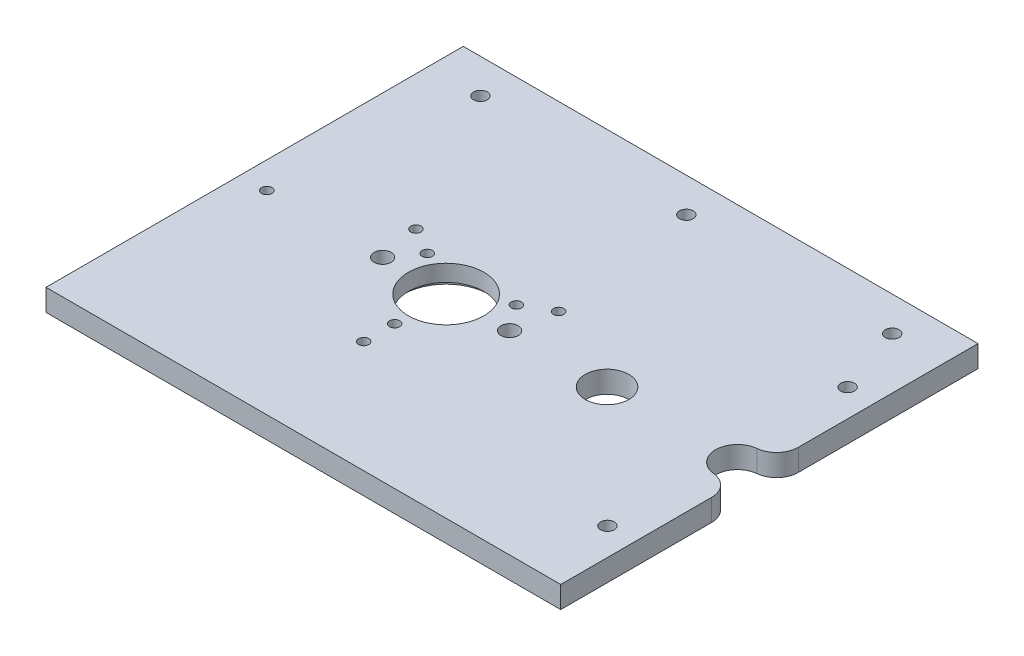
from build123d import *

# Parameters (mm, degrees)
CROQUIS1_W              = 150
CROQUIS1_H              = 101.6
SALIENTE_EXTRUIR1_DEPTH = 3.175
CROQUIS2_R              = 2
CROQUIS2_R_2            = 11
CROQUIS2_R_3            = 1.5
CROQUIS2_R_4            = 6.35
CORTAR_EXTRUIR1_DEPTH   = 91.807282197
REDONDEO1_R             = 6.35
CROQUIS3_R              = 1.5
CORTAR_EXTRUIR2_DEPTH   = 91.807282197
CORTAR_EXTRUIR3_START   = -3.175
CROQUIS4_R              = 12.5
CORTAR_EXTRUIR3_DEPTH   = 1.5
CROQUIS8_R              = 2.5
CORTAR_EXTRUIR5_DEPTH   = 91.807282197
CHAFL_N2_SIZE           = 2.5
CROQUIS9_R              = 2
SALIENTE_EXTRUIR2_DEPTH = 6.35


with BuildPart() as part:
    # Croquis1 → Saliente-Extruir1 (new, symmetric)
    with BuildSketch(Plane(origin=(0, 0, 0), x_dir=(1, 0, 0), z_dir=(0, 1, 0))):
        Rectangle(CROQUIS1_W, CROQUIS1_H)
    extrude(amount=SALIENTE_EXTRUIR1_DEPTH, both=True)

    # Croquis2 → Cortar-Extruir1 (cut, through all)
    with BuildSketch(Plane(origin=(0, 3.175, 0), x_dir=(1, 0, 0), z_dir=(0, 1, 0))):
        with Locations(Location((67, 40.8, 0), (0, 0, 270))):
            Circle(CROQUIS2_R)
        with Locations(Location((67, -29.2, 0), (0, 0, 90))):
            Circle(CROQUIS2_R)
        with Locations(Location((-15, 5.8, 0), (0, 0, 270))):
            Circle(CROQUIS2_R_2)
        with Locations(Location((-67.25, 5.8, 0), (0, 0, 270))):
            Circle(CROQUIS2_R_3)
        with Locations(Location((31.9, 5.8, 0), (0, 0, 270))):
            Circle(CROQUIS2_R_4)
        with Locations((69.9, 5.8)):
            Circle(CROQUIS2_R_4)
    extrude(amount=-CORTAR_EXTRUIR1_DEPTH, mode=Mode.SUBTRACT)

    # Redondeo1
    redondeo1_edges = [part.edges().sort_by_distance(p)[0] for p in [
        (75, 0, -2.016813512),
        (75, 0, -9.583186488),
    ]]
    fillet(redondeo1_edges, radius=REDONDEO1_R)

    # Croquis3 → Cortar-Extruir2 (cut, through all)
    with BuildSketch(Plane(origin=(0, 3.175, 0), x_dir=(1, 0, 0), z_dir=(0, 1, 0))):
        with Locations(Location((-15, -9.2, 0), (0, 0, 270))):
            Circle(CROQUIS3_R)
        with Locations(Location((-15, -18.2, 0), (0, 0, 270))):
            Circle(CROQUIS3_R)
        with Locations(Location((-27.990381057, 13.3, 0), (0, 0, 270))):
            Circle(CROQUIS3_R)
        with Locations(Location((-35.784609691, 17.8, 0), (0, 0, 270))):
            Circle(CROQUIS3_R)
        with Locations(Location((-2.009618943, 13.3, 0), (0, 0, 270))):
            Circle(CROQUIS3_R)
        with Locations(Location((5.784609691, 17.8, 0), (0, 0, 270))):
            Circle(CROQUIS3_R)
    extrude(amount=-CORTAR_EXTRUIR2_DEPTH, mode=Mode.SUBTRACT)

    # Croquis4 → Cortar-Extruir3 (cut)
    with BuildSketch(Plane(origin=(0, 0, 0), x_dir=(1, 0, 0), z_dir=(0, 1, 0)).offset(CORTAR_EXTRUIR3_START)):
        with Locations(Location((-15, 5.8, 0), (0, 0, 270))):
            Circle(CROQUIS4_R)
    extrude(amount=CORTAR_EXTRUIR3_DEPTH, mode=Mode.SUBTRACT)

    # Croquis8 → Cortar-Extruir5 (cut, through all)
    with BuildSketch(Plane.XZ.offset(3.175)):
        with Locations(Location((3.5, -5.8, 0), (0, 0, 270))):
            Circle(CROQUIS8_R)
        with Locations(Location((-33.5, -5.8, 0), (0, 0, 90))):
            Circle(CROQUIS8_R)
    extrude(amount=-CORTAR_EXTRUIR5_DEPTH, mode=Mode.SUBTRACT)

    # Chaflán2
    chafl_n2_edges = [part.edges().sort_by_distance(p)[0] for p in [
        (3.5, -3.175, -3.3),
        (-33.5, -3.175, -8.3),
    ]]
    chamfer(chafl_n2_edges, length=CHAFL_N2_SIZE)

    # Croquis9 → Saliente-Extruir2 (add)
    with BuildSketch(Plane.XZ.offset(3.175)):
        Polygon((0, -50.8), (-75, -50.8), (-75, -70.8), (75, -70.8), (75, -50.8), align=None)
        with Locations(Location((0, -60.8, 0), (0, 0, 270))):
            Circle(CROQUIS9_R, mode=Mode.SUBTRACT)
        with Locations(Location((-60, -60.8, 0), (0, 0, 270))):
            Circle(CROQUIS9_R, mode=Mode.SUBTRACT)
        with Locations(Location((60, -60.8, 0), (0, 0, 270))):
            Circle(CROQUIS9_R, mode=Mode.SUBTRACT)
    extrude(amount=-SALIENTE_EXTRUIR2_DEPTH)


solid = part.part
